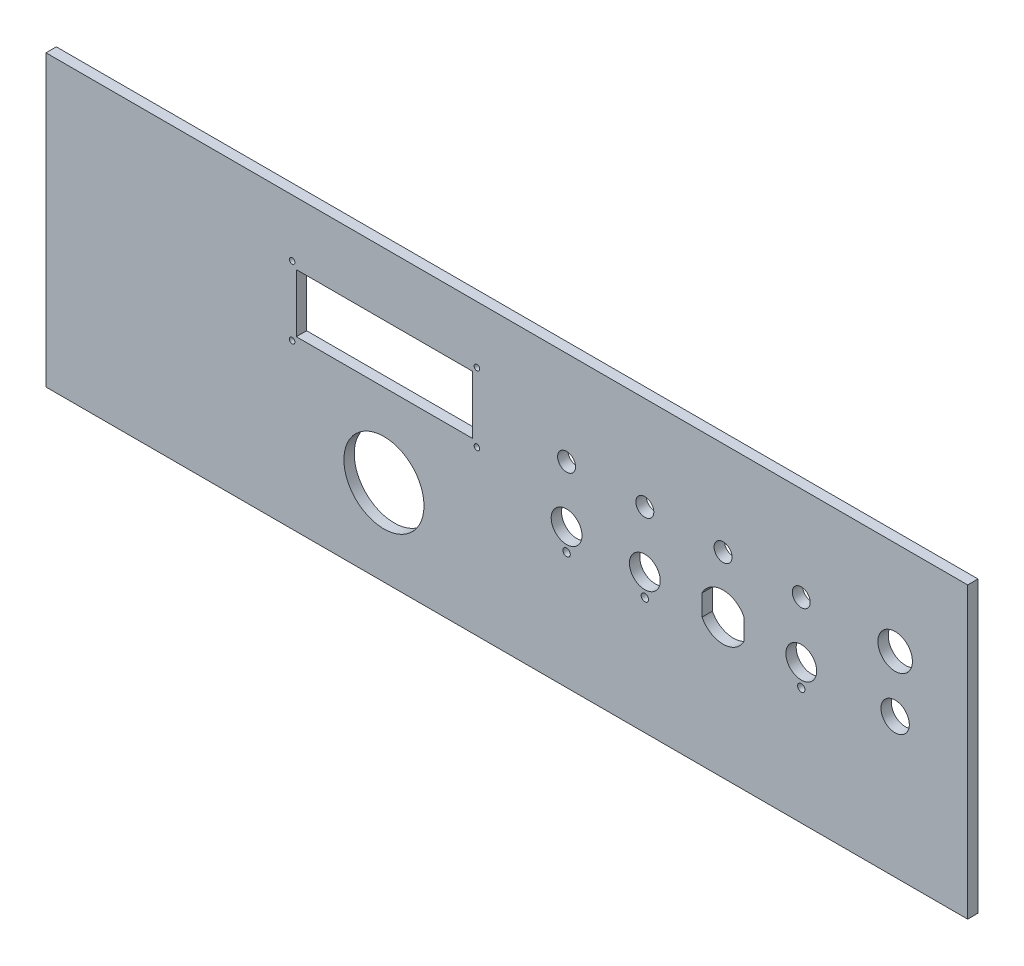
from build123d import *

# Parameters (mm, degrees)
SKETCH2_W             = 374.0912
SKETCH2_H             = 117.5004
SKETCH2_R             = 16.25
SKETCH2_W_2           = 71.6
SKETCH2_H_2           = 23.6
BOSS_EXTRUDE1_DEPTH   = 4.191
F_4_40_TAPPED_HOLE1_D = 2.2606
SKETCH7_R             = 3.6449
SKETCH7_R_2           = 6.2484
SKETCH7_R_3           = 1.4986
SKETCH7_R_4           = 7
SKETCH7_R_5           = 5.7531
CUT_EXTRUDE1_DEPTH    = 393.132801993


with BuildPart() as part:
    # Sketch2 → Boss-Extrude1 (new body)
    with BuildSketch(Plane.XY):
        with Locations((187.0456, 58.7502)):
            Rectangle(SKETCH2_W, SKETCH2_H)
        with Locations((137.16, 34.9504)):
            Circle(SKETCH2_R, mode=Mode.SUBTRACT)
        with Locations((137.4, 80.3004)):
            Rectangle(SKETCH2_W_2, SKETCH2_H_2, mode=Mode.SUBTRACT)
    extrude(amount=BOSS_EXTRUDE1_DEPTH)

    # #4-40 Tapped Hole1 (through all)
    with Locations(Plane.XY.offset(4.191)):
        with Locations((99.9, 94.3004), (174.9, 94.3004), (174.9, 66.3004), (99.9, 66.3004)):
            Hole(F_4_40_TAPPED_HOLE1_D / 2)

    # Sketch7 → Cut-Extrude1 (cut, through all)
    with BuildSketch(Plane.XY.offset(4.191)):
        with Locations((211.3, 79.4004)):
            Circle(SKETCH7_R)
        with Locations((211.3, 56.5404)):
            Circle(SKETCH7_R_2)
        with Locations((211.3, 47.5488)):
            Circle(SKETCH7_R_3)
        with Locations((243.05, 79.4004)):
            Circle(SKETCH7_R)
        with Locations((243.05, 56.5404)):
            Circle(SKETCH7_R_2)
        with Locations((243.05, 47.5488)):
            Circle(SKETCH7_R_3)
        with Locations((274.8, 79.4004)):
            Circle(SKETCH7_R)
        with Locations((306.55, 79.4004)):
            Circle(SKETCH7_R)
        with Locations((306.55, 56.5404)):
            Circle(SKETCH7_R_2)
        with Locations((306.55, 47.5488)):
            Circle(SKETCH7_R_3)
        with Locations((344.65, 79.4004)):
            Circle(SKETCH7_R_4)
        with Locations((344.65, 56.5404)):
            Circle(SKETCH7_R_5)
        with BuildLine():
            Line((266.291, 52.288251097), (266.291, 60.792548903))
            ThreePointArc((266.291, 60.792548903), (274.8, 66.0527), (283.309, 60.792548903))
            Line((283.309, 60.792548903), (283.309, 52.288251097))
            ThreePointArc((283.309, 52.288251097), (274.8, 47.0281), (266.291, 52.288251097))
        make_face()
    extrude(amount=-CUT_EXTRUDE1_DEPTH, mode=Mode.SUBTRACT)


solid = part.part
